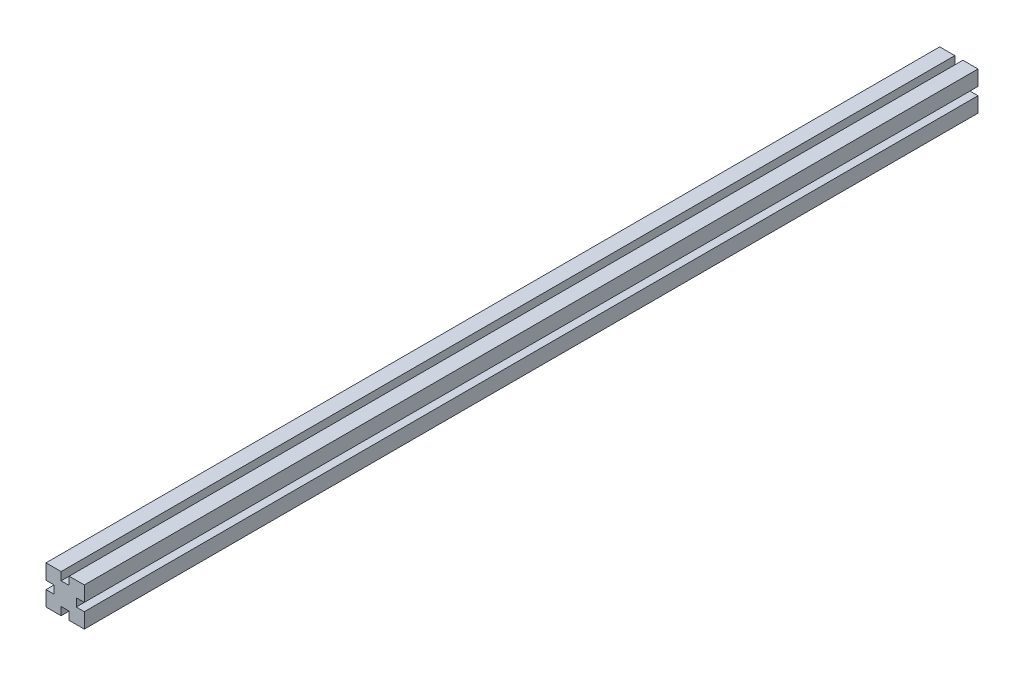
from build123d import *

# Parameters (mm, degrees)
PROFILE_DEPTH = 889


with BuildPart() as part:
    # Sketch1 → Profile (new body)
    with BuildSketch(Plane.XY):
        Polygon((-19.05, -19.05), (-4, -19.05), (-4, -11.05), (4, -11.05), (4, -19.05), (19.05, -19.05), (19.05, -4), (11.05, -4), (11.05, 4), (19.05, 4), (19.05, 19.05), (4, 19.05), (4, 11.05), (-4, 11.05), (-4, 19.05), (-19.05, 19.05), (-19.05, 4), (-11.05, 4), (-11.05, -4), (-19.05, -4), align=None)
    extrude(amount=PROFILE_DEPTH)


solid = part.part
